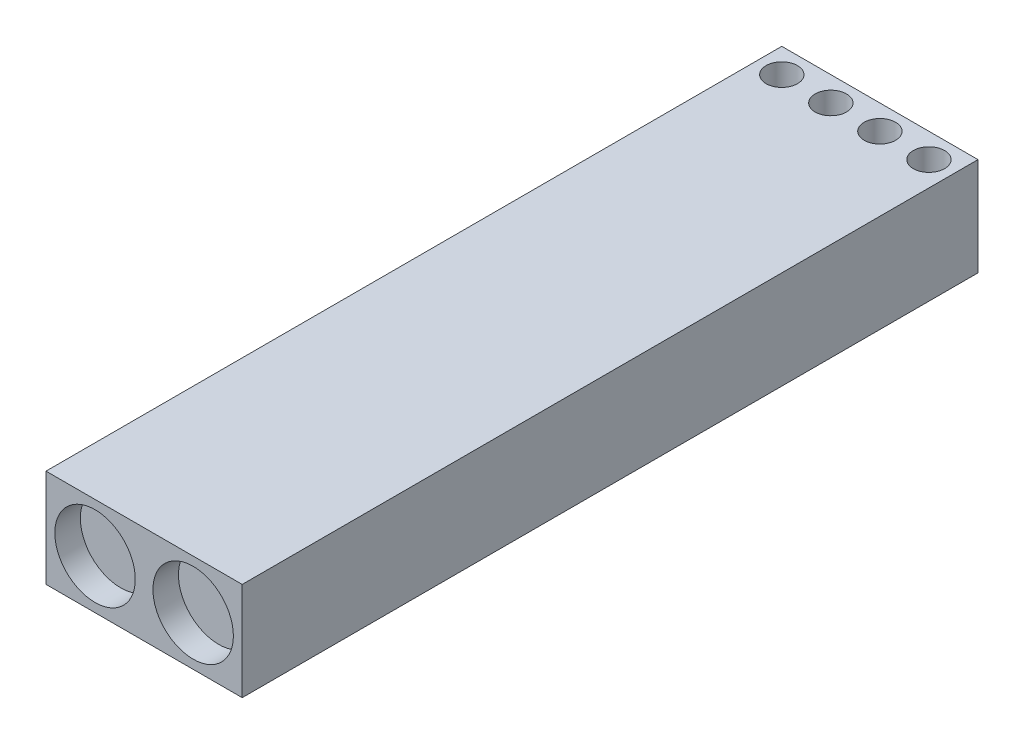
from build123d import *

# Parameters (mm, degrees)
SKETCH_1_W               = 20
SKETCH_1_H               = 20
EXTRUDE_1_DEPTH          = 150
SKETCH_2_R               = 8.2
CUT_EXTRUDE_1_DEPTH      = 5.2
SKETCH_3_R               = 3.2
CUT_EXTRUDE_2_DEPTH      = 18
MIRROR_2_COPY_1_SKETCH_R = 3.2
MIRROR_2_COPY_1_DEPTH    = 18


with BuildPart() as part:
    # ｽｹｯﾁ1 → ﾎﾞｽ - 押し出し1 (new body)
    with BuildSketch(Plane.XY):
        Rectangle(SKETCH_1_W, SKETCH_1_H)
    extrude_1 = extrude(amount=EXTRUDE_1_DEPTH)

    # ｽｹｯﾁ2 → ｶｯﾄ - 押し出し1 (cut)
    with BuildSketch(Plane.XY.offset(150)):
        Circle(SKETCH_2_R)
    cut_extrude_1 = extrude(amount=-CUT_EXTRUDE_1_DEPTH, mode=Mode.SUBTRACT)

    # ｽｹｯﾁ3 → ｶｯﾄ - 押し出し2 (cut)
    with BuildSketch(Plane(origin=(0, 10, 0), x_dir=(1, 0, 0), z_dir=(0, 1, 0))):
        with Locations(Location((5, -5, 0), (0, 0, 270))):
            Circle(SKETCH_3_R)
    cut_extrude_2 = extrude(amount=-CUT_EXTRUDE_2_DEPTH, mode=Mode.SUBTRACT)

    # ﾐﾗｰ1: ｶｯﾄ - 押し出し2 across plane
    add(cut_extrude_2.mirror(Plane(origin=(0, 0, 0), x_dir=(0, 0, 1), z_dir=(1, 0, 0))), mode=Mode.SUBTRACT)

    # ﾐﾗｰ2: ﾎﾞｽ - 押し出し1, ｶｯﾄ - 押し出し1, ｶｯﾄ - 押し出し2 across plane
    add(extrude_1.mirror(Plane(origin=(-10, 10, 150), x_dir=(0, 0, 1), z_dir=(1, 0, 0))))
    add(cut_extrude_1.mirror(Plane(origin=(-10, 10, 150), x_dir=(0, 0, 1), z_dir=(1, 0, 0))), mode=Mode.SUBTRACT)
    add(cut_extrude_2.mirror(Plane(origin=(-10, 10, 150), x_dir=(0, 0, 1), z_dir=(1, 0, 0))), mode=Mode.SUBTRACT)

    # ﾐﾗｰ2 copy 1 sketch → ﾐﾗｰ2 copy 1 (cut)
    with BuildSketch(Plane(origin=(-20, 10, 0), x_dir=(1, 0, 0), z_dir=(0, 1, 0))):
        with Locations(Location((5, -5, 0), (0, 0, 270))):
            Circle(MIRROR_2_COPY_1_SKETCH_R)
    extrude(amount=-MIRROR_2_COPY_1_DEPTH, mode=Mode.SUBTRACT)


solid = part.part
